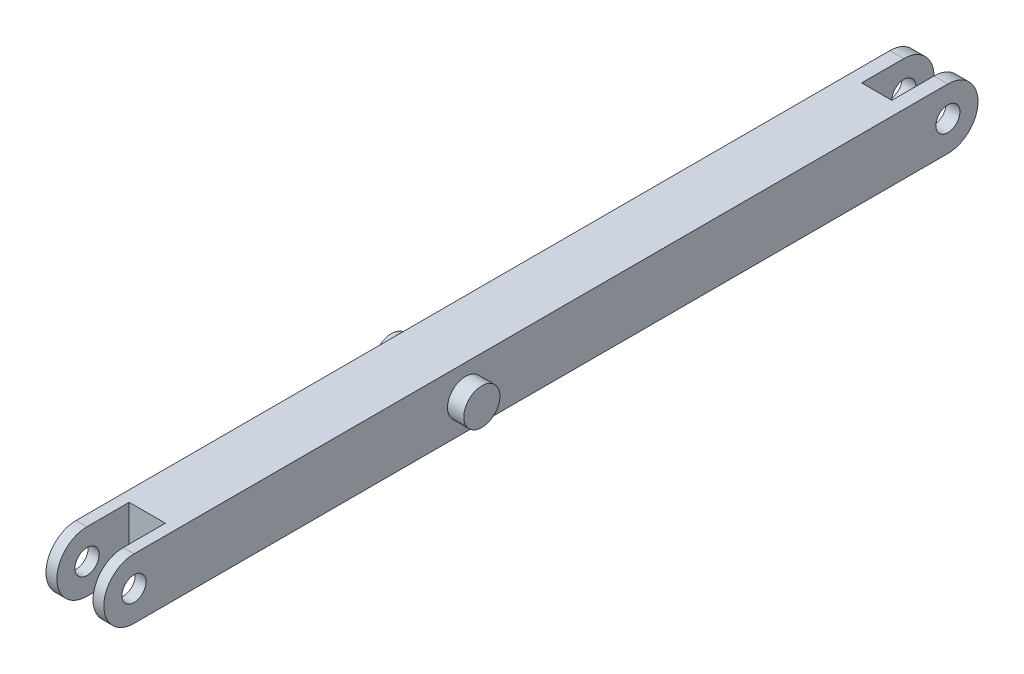
from build123d import *

# Parameters (mm, degrees)
SKETCH1_R           = 10
BOSS_EXTRUDE1_DEPTH = 24
SKETCH2_W           = 25
SKETCH2_H           = 60
SKETCH2_W_2         = 30
CUT_EXTRUDE1_DEPTH  = 429.603546416
SKETCH3_R           = 15
BOSS_EXTRUDE2_DEPTH = 37.5


with BuildPart() as part:
    # Sketch1 → Boss-Extrude1 (new, symmetric)
    with BuildSketch(Plane(origin=(0, 0, 0), x_dir=(0, 0, -1), z_dir=(1, 0, 0))):
        with BuildLine():
            Line((-275, 25), (400, 25))
            ThreePointArc((400, 25), (425, 0), (400, -25))
            Line((400, -25), (-275, -25))
            ThreePointArc((-275, -25), (-300, 0), (-275, 25))
        make_face()
        with Locations((-275, 0)):
            Circle(SKETCH1_R, mode=Mode.SUBTRACT)
        with Locations((400, 0)):
            Circle(SKETCH1_R, mode=Mode.SUBTRACT)
    extrude(amount=BOSS_EXTRUDE1_DEPTH, both=True)

    # Sketch2 → Cut-Extrude1 (cut, through all)
    with BuildSketch(Plane(origin=(0, 25, 0), x_dir=(1, 0, 0), z_dir=(0, 1, 0))):
        with Locations((0, 395)):
            Rectangle(SKETCH2_W, SKETCH2_H)
        with Locations((0, -270)):
            Rectangle(SKETCH2_W_2, SKETCH2_H)
    extrude(amount=-CUT_EXTRUDE1_DEPTH, mode=Mode.SUBTRACT)

    # Sketch3 → Boss-Extrude2 (add, symmetric)
    with BuildSketch(Plane(origin=(0, 0, 0), x_dir=(0, 0, -1), z_dir=(1, 0, 0))):
        Circle(SKETCH3_R)
    extrude(amount=BOSS_EXTRUDE2_DEPTH, both=True)


solid = part.part
